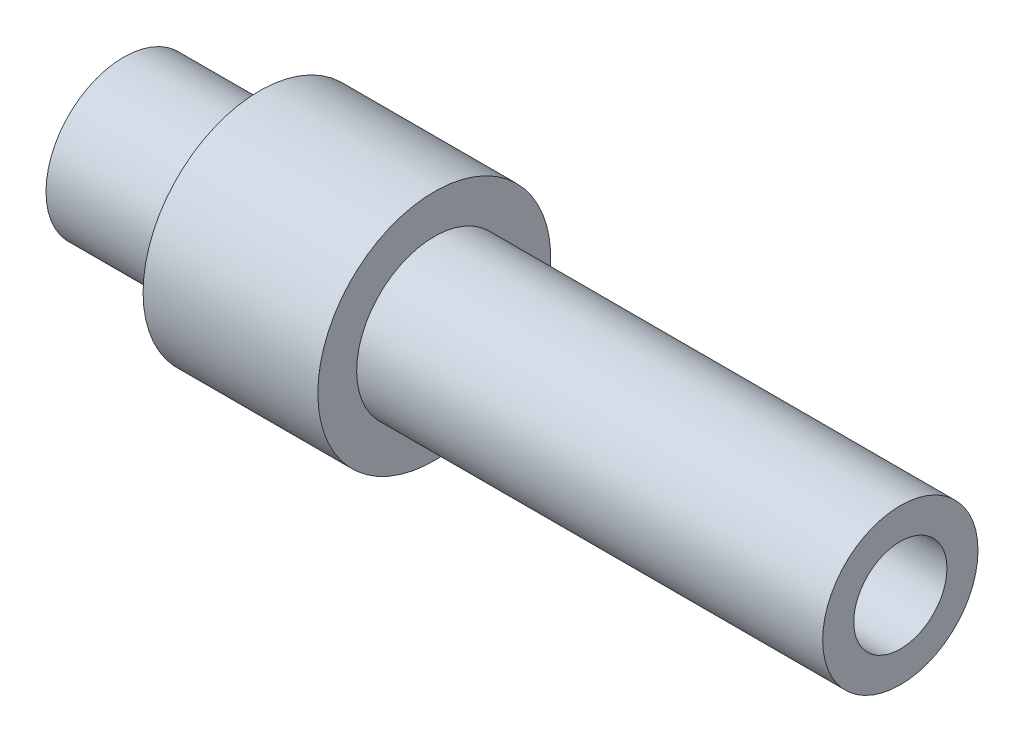
from build123d import *

# Parameters (mm, degrees)
SKETCH1_R           = 4
BOSS_EXTRUDE1_DEPTH = 40
SKETCH2_R           = 2
CUT_EXTRUDE1_DEPTH  = 6
BOSS_EXTRUDE2_START = -7
SKETCH3_R           = 6
SKETCH3_R_2         = 2
BOSS_EXTRUDE2_DEPTH = 9
SKETCH4_R           = 2.4
CUT_EXTRUDE2_DEPTH  = 16


with BuildPart() as part:
    # Sketch1 → Boss-Extrude1 (new body)
    with BuildSketch(Plane(origin=(0, 0, 0), x_dir=(0, 0, -1), z_dir=(1, 0, 0))):
        Circle(SKETCH1_R)
    extrude(amount=BOSS_EXTRUDE1_DEPTH)

    # Sketch2 → Cut-Extrude1 (cut)
    with BuildSketch(Plane.ZY):
        Circle(SKETCH2_R)
    extrude(amount=-CUT_EXTRUDE1_DEPTH, mode=Mode.SUBTRACT)

    # Sketch3 → Boss-Extrude2 (add)
    with BuildSketch(Plane.ZY.offset(BOSS_EXTRUDE2_START)):
        Circle(SKETCH3_R)
        Circle(SKETCH3_R_2, mode=Mode.SUBTRACT)
    extrude(amount=-BOSS_EXTRUDE2_DEPTH)

    # Sketch4 → Cut-Extrude2 (cut)
    with BuildSketch(Plane(origin=(40, 0, 0), x_dir=(0, 0, -1), z_dir=(1, 0, 0))):
        Circle(SKETCH4_R)
    extrude(amount=-CUT_EXTRUDE2_DEPTH, mode=Mode.SUBTRACT)


solid = part.part
